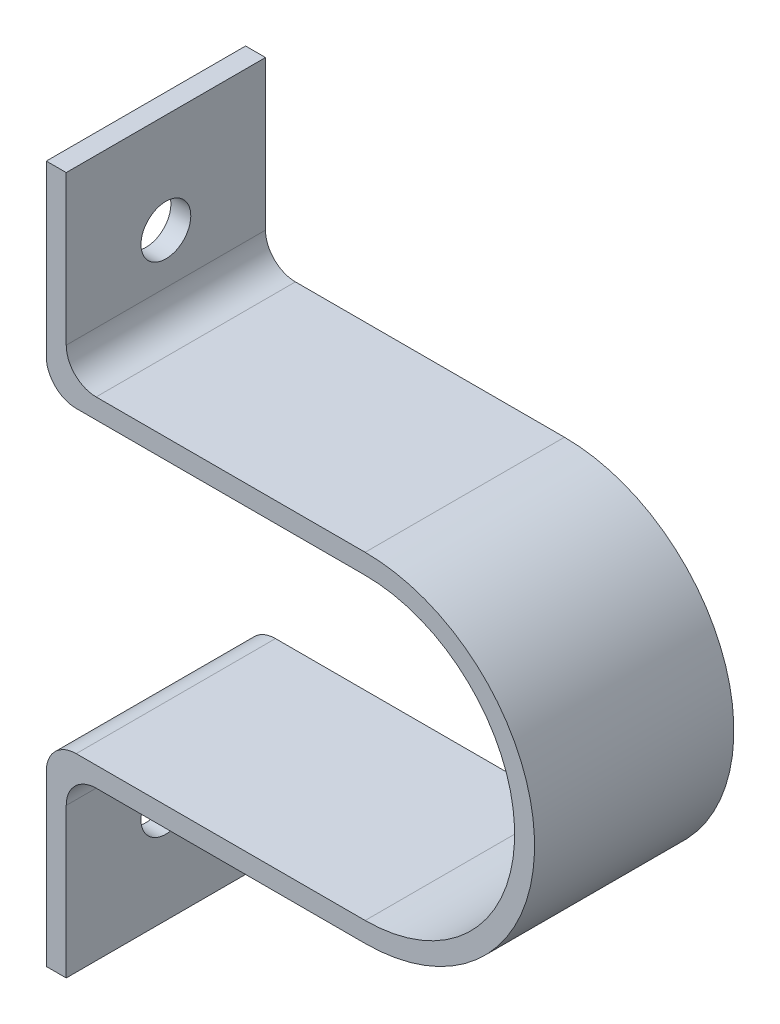
from build123d import *

# Parameters (mm, degrees)
BOSS_EXTRUDE1_START = -10
BOSS_EXTRUDE1_DEPTH = 20
SKETCH2_R           = 2.5
CUT_EXTRUDE1_DEPTH  = 79.319856997
FILLET1_R           = 3


with BuildPart() as part:
    # Sketch1 → Boss-Extrude1 (new body)
    with BuildSketch(Plane.XY.offset(BOSS_EXTRUDE1_START)):
        with BuildLine():
            Line((40, -5), (8, -5))
            Line((8, -5), (8, 15))
            Line((8, 15), (10, 15))
            Line((10, 15), (10, -3))
            Line((10, -3), (40, -3))
            ThreePointArc((40, -3), (57, -20), (40, -37))
            Line((40, -37), (10, -37))
            Line((10, -37), (10, -55))
            Line((10, -55), (8, -55))
            Line((8, -55), (8, -35))
            Line((8, -35), (40, -35))
            ThreePointArc((40, -35), (55, -20), (40, -5))
        make_face()
    extrude(amount=-BOSS_EXTRUDE1_DEPTH)

    # Sketch2 → Cut-Extrude1 (cut, through all)
    with BuildSketch(Plane(origin=(10, 0, 0), x_dir=(0, 0, -1), z_dir=(1, 0, 0))):
        with Locations(Location((20, 5, 0), (0, 0, 90))):
            Circle(SKETCH2_R)
        with Locations(Location((20, -45, 0), (0, 0, 90))):
            Circle(SKETCH2_R)
    extrude(amount=-CUT_EXTRUDE1_DEPTH, mode=Mode.SUBTRACT)

    # Fillet1
    fillet1_edges = [part.edges().sort_by_distance(p)[0] for p in [
        (10, -37, -20),
        (8, -35, -20),
        (8, -5, -20),
        (10, -3, -20),
    ]]
    fillet(fillet1_edges, radius=FILLET1_R)


solid = part.part
